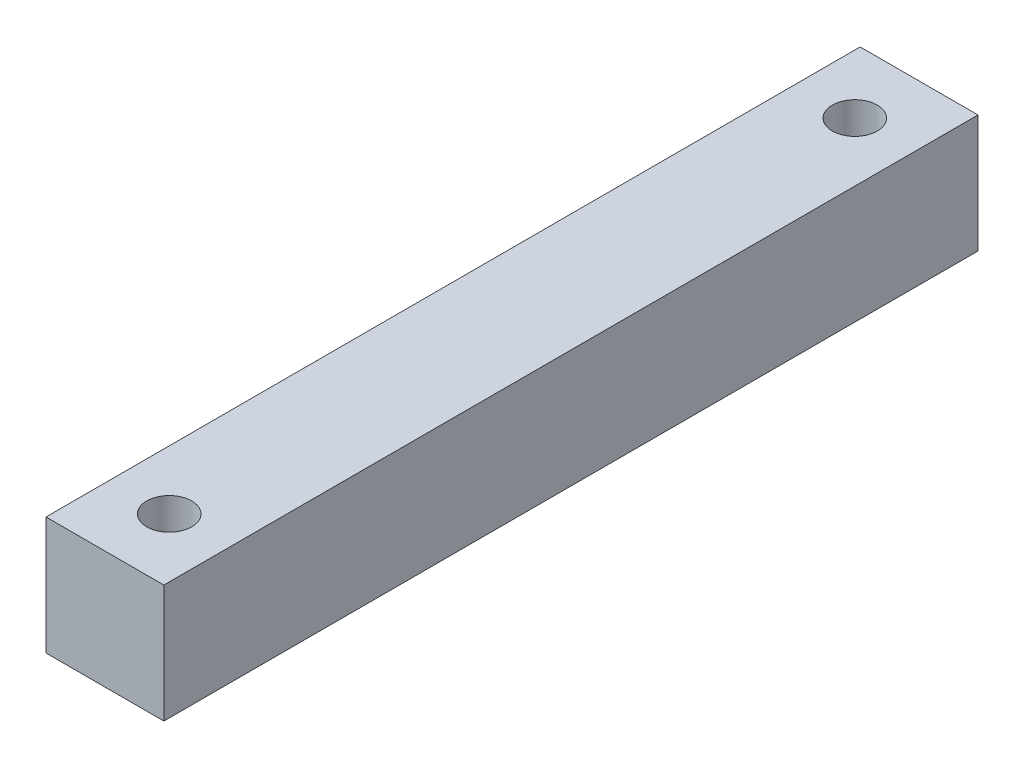
from build123d import *

# Parameters (mm, degrees)
SKETCH_1_W          = 5.5
SKETCH_1_H          = 5.5
EXTRUDE_1_DEPTH     = 38
SKETCH_2_R          = 1.05
CUT_EXTRUDE_1_DEPTH = 5.5


with BuildPart() as part:
    # ｽｹｯﾁ1 → ﾎﾞｽ - 押し出し1 (new body)
    with BuildSketch(Plane.XY):
        Rectangle(SKETCH_1_W, SKETCH_1_H)
    extrude(amount=EXTRUDE_1_DEPTH)

    # ｽｹｯﾁ2 → ｶｯﾄ - 押し出し1 (cut)
    with BuildSketch(Plane(origin=(0, 2.75, 0), x_dir=(1, 0, 0), z_dir=(0, 1, 0))):
        with Locations(Location((0, -3, 0), (0, 0, 180))):
            Circle(SKETCH_2_R)
        with Locations(Location((0, -35, 0), (0, 0, 180))):
            Circle(SKETCH_2_R)
    extrude(amount=-CUT_EXTRUDE_1_DEPTH, mode=Mode.SUBTRACT)


solid = part.part
